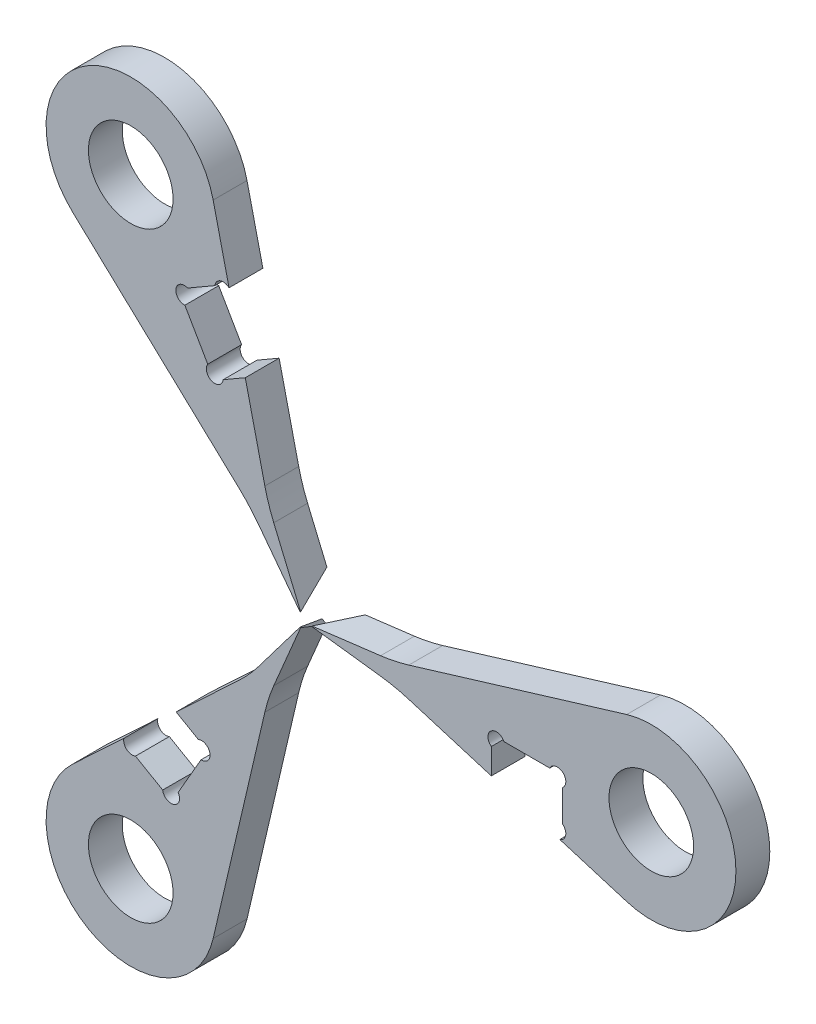
from build123d import *

# Parameters (mm, degrees)
SKETCH_1_R          = 2.5
EXTRUDE_1_DEPTH     = 2
EXTRUDE_1_2_DEPTH   = 2
EXTRUDE_1_3_DEPTH   = 2
CUT_EXTRUDE_1_DEPTH = 35.234086928


with BuildPart() as part:
    # 草圖1 → 填料-伸長1 (new body)
    with BuildSketch(Plane.XY):
        with BuildLine():
            Line((0.357380647, 0.004961492), (4.50941379, 0.523267787))
            ThreePointArc((4.50941379, 0.523267787), (5.349803134, 0.664770922), (6.175092484, 0.877314741))
            Line((6.175092484, 0.877314741), (19.047808057, 4.784468472))
            ThreePointArc((19.047808057, 4.784468472), (25.5, 0), (19.047808057, -4.784468472))
            Line((19.047808057, -4.784468472), (6.175092484, -0.877314741))
            ThreePointArc((6.175092484, -0.877314741), (5.349803134, -0.664770922), (4.50941379, -0.523267787))
            Line((4.50941379, -0.523267787), (0.357380647, -0.004961492))
            ThreePointArc((0.357380647, -0.004961492), (0.353, 0), (0.357380647, 0.004961492))
        make_face()
        with Locations((20.5, 0)):
            Circle(SKETCH_1_R, mode=Mode.SUBTRACT)
    extrude(amount=EXTRUDE_1_DEPTH)


with BuildPart() as body_2:
    # 草圖1 → Extrude 1 2 (new body)
    with BuildSketch(Plane.XY):
        with BuildLine():
            Line((-2.327769389, -5.786444332), (-5.380432788, -18.8881199))
            ThreePointArc((-5.380432788, -18.8881199), (-12.75, -22.083647797), (-13.667375269, -14.103651428))
            Line((-13.667375269, -14.103651428), (-3.847323094, -4.909129591))
            ThreePointArc((-3.847323094, -4.909129591), (-3.250610073, -4.300679958), (-2.707870091, -3.643633005))
            Line((-2.707870091, -3.643633005), (-0.182987102, -0.307019973))
            ThreePointArc((-0.182987102, -0.307019973), (-0.1765, -0.305706968), (-0.174393546, -0.311981465))
            Line((-0.174393546, -0.311981465), (-1.801543699, -4.166900792))
            ThreePointArc((-1.801543699, -4.166900792), (-2.09919306, -4.96545088), (-2.327769389, -5.786444332))
        make_face()
        with Locations((-10.25, -17.753520778)):
            Circle(SKETCH_1_R, mode=Mode.SUBTRACT)
    extrude(amount=EXTRUDE_1_2_DEPTH)


with BuildPart() as body_3:
    # 草圖1 → Extrude 1 3 (new body)
    with BuildSketch(Plane.XY):
        with BuildLine():
            Line((-3.847323094, 4.909129591), (-13.667375269, 14.103651428))
            ThreePointArc((-13.667375269, 14.103651428), (-12.75, 22.083647797), (-5.380432788, 18.8881199))
            Line((-5.380432788, 18.8881199), (-2.327769389, 5.786444332))
            ThreePointArc((-2.327769389, 5.786444332), (-2.09919306, 4.96545088), (-1.801543699, 4.166900792))
            Line((-1.801543699, 4.166900792), (-0.174393546, 0.311981465))
            ThreePointArc((-0.174393546, 0.311981465), (-0.1765, 0.305706968), (-0.182987102, 0.307019973))
            Line((-0.182987102, 0.307019973), (-2.707870091, 3.643633005))
            ThreePointArc((-2.707870091, 3.643633005), (-3.250610073, 4.300679958), (-3.847323094, 4.909129591))
        make_face()
        with Locations((-10.25, 17.753520778)):
            Circle(SKETCH_1_R, mode=Mode.SUBTRACT)
    extrude(amount=EXTRUDE_1_3_DEPTH)


with BuildPart() as cut_extrude_1_tool:
    # 草圖2 → 除料-伸長1 (new, through all)
    with BuildSketch(Plane.XY.offset(2)):
        with BuildLine():
            ThreePointArc((11.798296094, -0.228571429), (11.03056096, -0.065346), (11.05, -0.85))
            Line((11.05, -0.85), (11.05, -2.356956933))
            Line((11.05, -2.356956933), (15.09656548, -3.585179007))
            ThreePointArc((15.09656548, -3.585179007), (15.442536346, -3.193212295), (15.25, -2.707142857))
            Line((15.25, -2.707142857), (15.25, -0.85))
            ThreePointArc((15.25, -0.85), (15.26943904, -0.065346), (14.501703906, -0.228571429))
            Line((14.501703906, -0.228571429), (11.798296094, -0.228571429))
        make_face()
        with BuildLine():
            ThreePointArc((-6.888878407, 13.631887408), (-7.578128224, 13.25639511), (-7.052903289, 12.673129695))
            Line((-7.052903289, 12.673129695), (-5.701199383, 10.331909853))
            ThreePointArc((-5.701199383, 10.331909853), (-5.458689184, 9.585419009), (-4.788878407, 9.994580712))
            Line((-4.788878407, 9.994580712), (-3.48381542, 10.748059178))
            Line((-3.48381542, 10.748059178), (-4.443426643, 14.866598719))
            ThreePointArc((-4.443426643, 14.866598719), (-4.955865206, 14.970234922), (-5.280545514, 14.560458836))
            Line((-5.280545514, 14.560458836), (-6.888878407, 13.631887408))
        make_face()
        with BuildLine():
            ThreePointArc((-6.097096711, -10.103338424), (-5.571871776, -9.520073009), (-6.261121593, -9.144580712))
            Line((-6.261121593, -9.144580712), (-7.56618458, -8.391102245))
            Line((-7.56618458, -8.391102245), (-10.653138837, -11.281419712))
            ThreePointArc((-10.653138837, -11.281419712), (-10.48667114, -11.777022627), (-9.969454486, -11.853315979))
            Line((-9.969454486, -11.853315979), (-8.361121593, -12.781887408))
            ThreePointArc((-8.361121593, -12.781887408), (-7.691310816, -13.19104911), (-7.448800617, -12.444558267))
            Line((-7.448800617, -12.444558267), (-6.097096711, -10.103338424))
        make_face()
    extrude(amount=-CUT_EXTRUDE_1_DEPTH)


with BuildPart() as part_1:
    add(part.part)

    # 除料-伸長1: cut by cut_extrude_1_tool
    add(cut_extrude_1_tool.part, mode=Mode.SUBTRACT)


with BuildPart() as body_2_1:
    add(body_2.part)

    # 除料-伸長1: cut by cut_extrude_1_tool
    add(cut_extrude_1_tool.part, mode=Mode.SUBTRACT)


with BuildPart() as body_3_1:
    add(body_3.part)

    # 除料-伸長1: cut by cut_extrude_1_tool
    add(cut_extrude_1_tool.part, mode=Mode.SUBTRACT)


with BuildPart() as cut_revolve_1_tool:
    # 草圖3 → 除料-旋轉1 (revolve)
    with BuildSketch(Plane(origin=(0, 0, 0), x_dir=(1, 0, 0), z_dir=(0, 1, 0))):
        Polygon((0.353, -2.18), (1.611623587, 0), (0.353, 0), align=None)
    revolve(axis=Axis((0, 0, -4.245852073), (0, 0, 1)))


with BuildPart() as part_2:
    add(part_1.part)

    # 除料-旋轉1: cut by cut_revolve_1_tool
    add(cut_revolve_1_tool.part, mode=Mode.SUBTRACT)


with BuildPart() as body_2_2:
    add(body_2_1.part)

    # 除料-旋轉1: cut by cut_revolve_1_tool
    add(cut_revolve_1_tool.part, mode=Mode.SUBTRACT)


with BuildPart() as body_3_2:
    add(body_3_1.part)

    # 除料-旋轉1: cut by cut_revolve_1_tool
    add(cut_revolve_1_tool.part, mode=Mode.SUBTRACT)


solid = Compound([part_2.part, body_2_2.part, body_3_2.part])
